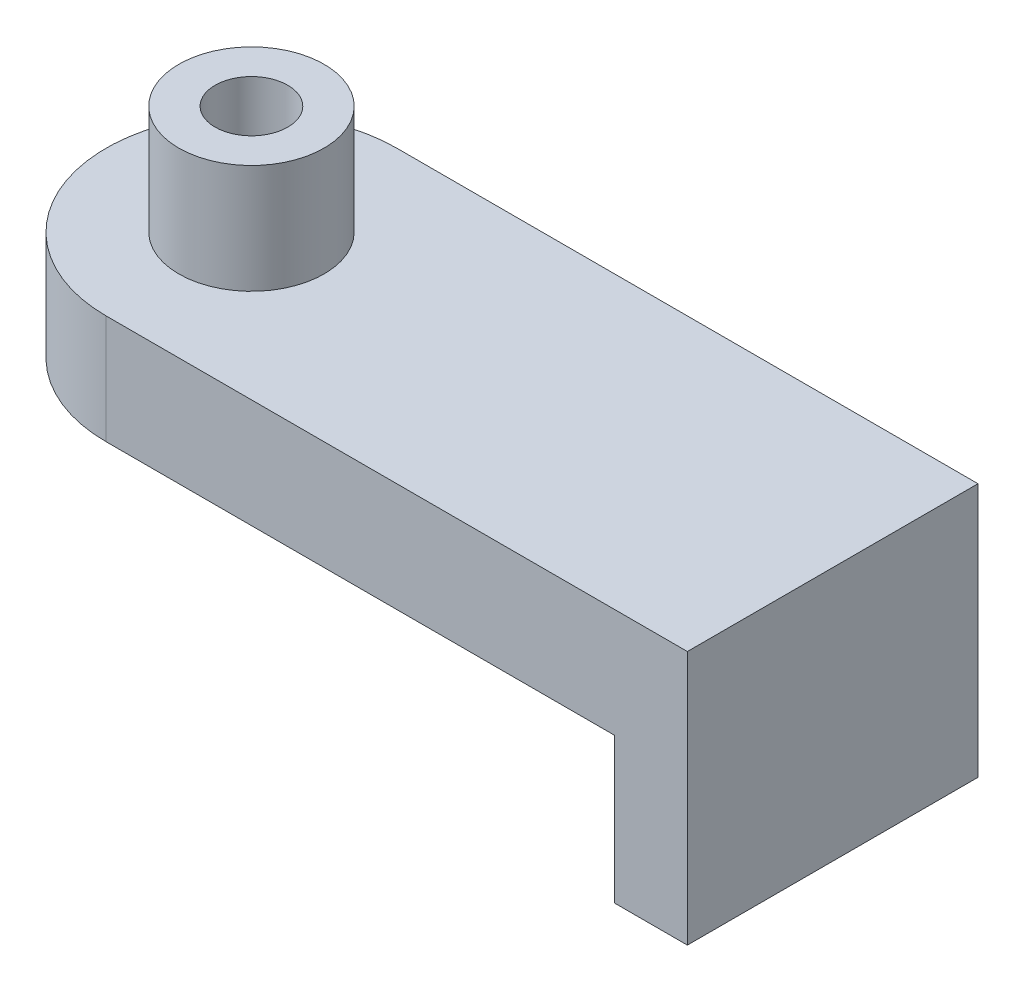
from build123d import *

# Parameters (mm, degrees)
CROQUIS2_R              = 5
SALIENTE_EXTRUIR1_DEPTH = 15
CROQUIS3_R              = 10
CROQUIS3_R_2            = 5
SALIENTE_EXTRUIR2_DEPTH = 15
CROQUIS4_W              = 10
CROQUIS4_H              = 40
SALIENTE_EXTRUIR3_DEPTH = 20


with BuildPart() as part:
    # Croquis2 → Saliente-Extruir1 (new body)
    with BuildSketch(Plane(origin=(0, 0, 0), x_dir=(1, 0, 0), z_dir=(0, 1, 0))):
        with BuildLine():
            Line((0, 0), (80, 0))
            Line((80, 0), (80, 40))
            Line((80, 40), (0, 40))
            ThreePointArc((0, 40), (-20, 20), (0, 0))
        make_face()
        with Locations(Location((0, 20, 0), (0, 0, 270))):
            Circle(CROQUIS2_R, mode=Mode.SUBTRACT)
    extrude(amount=SALIENTE_EXTRUIR1_DEPTH)

    # Croquis3 → Saliente-Extruir2 (add)
    with BuildSketch(Plane(origin=(0, 15, 0), x_dir=(1, 0, 0), z_dir=(0, 1, 0))):
        with Locations(Location((0, 20, 0), (0, 0, 270))):
            Circle(CROQUIS3_R)
        with Locations(Location((0, 20, 0), (0, 0, 270))):
            Circle(CROQUIS3_R_2, mode=Mode.SUBTRACT)
    extrude(amount=SALIENTE_EXTRUIR2_DEPTH)

    # Croquis4 → Saliente-Extruir3 (add)
    with BuildSketch(Plane.XZ):
        with Locations((75, -20)):
            Rectangle(CROQUIS4_W, CROQUIS4_H)
    extrude(amount=SALIENTE_EXTRUIR3_DEPTH)


solid = part.part
